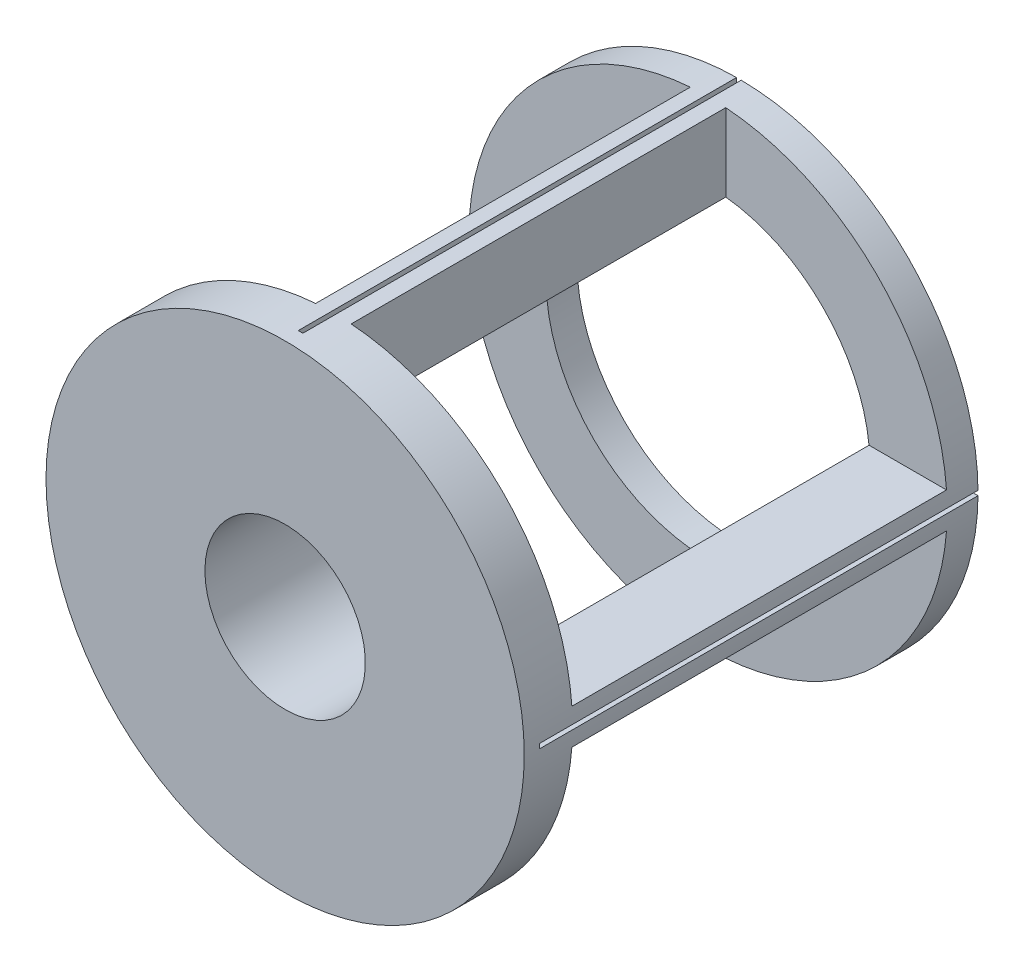
from build123d import *
from build123d.topology import SkipClean

# Parameters (mm, degrees)
CUT_EXTRUDE2_REACH = 368.826
CUT_EXTRUDE3_REACH = 388.826
CUT_EXTRUDE3_START = -20


with BuildPart() as part:
    # Sketch1 → Revolve1 (revolve)
    with BuildSketch(Plane(origin=(0, 0, 0), x_dir=(1, 0, 0), z_dir=(0, 1, 0)), mode=Mode.PRIVATE) as revolve1_sk:
        Polygon((52, -44.128440367), (52, 30), (62, 30), (62, 0), (105, -15.779816514), (105, 250), (155, 250), (155, -44.128440367), align=None)
    revolve(revolve1_sk.sketch.rotate(Axis((0, 0, 0), (0, 0, 1)), 180), axis=Axis((0, 0, 0), (0, 0, 1)))

    # Cut-Extrude2: up to this cone (the profile starts outside it)
    with SkipClean():  # the faces are left unmerged after this step: merging them gives an invalid solid
        cut_extrude2_end = Plane(origin=(0, 0, -250), z_dir=(0, 0, 1)).offset(227.247707422) * Cone(2.725e-06, 387.16335, 142.078292578, align=(Align.CENTER, Align.CENTER, Align.MIN), mode=Mode.PRIVATE)
        # Sketch2 → Cut-Extrude2 (cut, up to the surface)
        with BuildSketch(Plane(origin=(0, 0, -250), x_dir=(-1, 0, 0), z_dir=(0, 0, -1)), mode=Mode.PRIVATE) as cut_extrude2_sk1:
            with BuildLine():
                Line((-1.5, 154.992741766), (-1.5, 104.989285168))
                ThreePointArc((-1.5, 104.989285168), (0, 105), (1.5, 104.989285168))
                Line((1.5, 104.989285168), (1.5, 154.992741766))
                ThreePointArc((1.5, 154.992741766), (0, 155), (-1.5, 154.992741766))
            make_face()
        cut_extrude2_tool1 = extrude(cut_extrude2_sk1.sketch, amount=-CUT_EXTRUDE2_REACH, mode=Mode.PRIVATE) - cut_extrude2_end
        add(cut_extrude2_tool1.solids().sort_by_distance((0, 129.997004, -250))[0], mode=Mode.SUBTRACT)
        # Sketch2 → Cut-Extrude2 (cut, up to the surface)
        with BuildSketch(Plane(origin=(0, 0, -250), x_dir=(-1, 0, 0), z_dir=(0, 0, -1)), mode=Mode.PRIVATE) as cut_extrude2_sk2:
            with BuildLine():
                Line((104.989285168, 1.5), (154.992741766, 1.5))
                ThreePointArc((154.992741766, 1.5), (155, 0), (154.992741766, -1.5))
                Line((154.992741766, -1.5), (104.989285168, -1.5))
                ThreePointArc((104.989285168, -1.5), (105, 0), (104.989285168, 1.5))
            make_face()
        cut_extrude2_tool2 = extrude(cut_extrude2_sk2.sketch, amount=-CUT_EXTRUDE2_REACH, mode=Mode.PRIVATE) - cut_extrude2_end
        add(cut_extrude2_tool2.solids().sort_by_distance((-129.997004, 0, -250))[0], mode=Mode.SUBTRACT)
        # Sketch2 → Cut-Extrude2 (cut, up to the surface)
        with BuildSketch(Plane(origin=(0, 0, -250), x_dir=(-1, 0, 0), z_dir=(0, 0, -1)), mode=Mode.PRIVATE) as cut_extrude2_sk3:
            with BuildLine():
                Line((-1.5, -104.989285168), (-1.5, -154.992741766))
                ThreePointArc((-1.5, -154.992741766), (0, -155), (1.5, -154.992741766))
                Line((1.5, -154.992741766), (1.5, -104.989285168))
                ThreePointArc((1.5, -104.989285168), (0, -105), (-1.5, -104.989285168))
            make_face()
        cut_extrude2_tool3 = extrude(cut_extrude2_sk3.sketch, amount=-CUT_EXTRUDE2_REACH, mode=Mode.PRIVATE) - cut_extrude2_end
        add(cut_extrude2_tool3.solids().sort_by_distance((0, -129.997004, -250))[0], mode=Mode.SUBTRACT)
        # Sketch2 → Cut-Extrude2 (cut, up to the surface)
        with BuildSketch(Plane(origin=(0, 0, -250), x_dir=(-1, 0, 0), z_dir=(0, 0, -1)), mode=Mode.PRIVATE) as cut_extrude2_sk4:
            with BuildLine():
                Line((-154.992741766, 1.5), (-104.989285168, 1.5))
                ThreePointArc((-104.989285168, 1.5), (-105, 0), (-104.989285168, -1.5))
                Line((-104.989285168, -1.5), (-154.992741766, -1.5))
                ThreePointArc((-154.992741766, -1.5), (-155, 0), (-154.992741766, 1.5))
            make_face()
        cut_extrude2_tool4 = extrude(cut_extrude2_sk4.sketch, amount=-CUT_EXTRUDE2_REACH, mode=Mode.PRIVATE) - cut_extrude2_end
        add(cut_extrude2_tool4.solids().sort_by_distance((129.997004, 0, -250))[0], mode=Mode.SUBTRACT)

    # Cut-Extrude3: up to this cone (the profile starts outside it)
    with SkipClean():  # the faces are left unmerged after this step: merging them gives an invalid solid
        cut_extrude3_end = Plane(origin=(0, 0, -230), z_dir=(0, 0, 1)).offset(185.943540704) * Cone(2.725e-06, 554.217204308, 203.382459296, align=(Align.CENTER, Align.CENTER, Align.MIN), mode=Mode.PRIVATE)
        # Sketch4 → Cut-Extrude3 (cut, up to the surface)
        with BuildSketch(Plane(origin=(0, 0, -250), x_dir=(-1, 0, 0), z_dir=(0, 0, -1)).offset(CUT_EXTRUDE3_START), mode=Mode.PRIVATE) as cut_extrude3_sk1:
            with BuildLine():
                Line((-154.572798383, -11.5), (-104.368338111, -11.5))
                ThreePointArc((-104.368338111, -11.5), (-74.246212025, -74.246212025), (-11.5, -104.368338111))
                Line((-11.5, -104.368338111), (-11.5, -154.572798383))
                ThreePointArc((-11.5, -154.572798383), (-109.601551084, -109.601551084), (-154.572798383, -11.5))
            make_face()
        cut_extrude3_tool1 = extrude(cut_extrude3_sk1.sketch, amount=-CUT_EXTRUDE3_REACH, mode=Mode.PRIVATE) - cut_extrude3_end
        add(cut_extrude3_tool1.solids().sort_by_distance((85.813767, -85.813767, -230))[0], mode=Mode.SUBTRACT)
        # Sketch4 → Cut-Extrude3 (cut, up to the surface)
        with BuildSketch(Plane(origin=(0, 0, -250), x_dir=(-1, 0, 0), z_dir=(0, 0, -1)).offset(CUT_EXTRUDE3_START), mode=Mode.PRIVATE) as cut_extrude3_sk2:
            with BuildLine():
                Line((11.5, -104.368338111), (11.5, -154.572798383))
                ThreePointArc((11.5, -154.572798383), (109.601551084, -109.601551084), (154.572798383, -11.5))
                Line((154.572798383, -11.5), (104.368338111, -11.5))
                ThreePointArc((104.368338111, -11.5), (74.246212025, -74.246212025), (11.5, -104.368338111))
            make_face()
        cut_extrude3_tool2 = extrude(cut_extrude3_sk2.sketch, amount=-CUT_EXTRUDE3_REACH, mode=Mode.PRIVATE) - cut_extrude3_end
        add(cut_extrude3_tool2.solids().sort_by_distance((-85.813767, -85.813767, -230))[0], mode=Mode.SUBTRACT)
        # Sketch4 → Cut-Extrude3 (cut, up to the surface)
        with BuildSketch(Plane(origin=(0, 0, -250), x_dir=(-1, 0, 0), z_dir=(0, 0, -1)).offset(CUT_EXTRUDE3_START), mode=Mode.PRIVATE) as cut_extrude3_sk3:
            with BuildLine():
                Line((154.572798383, 11.5), (104.368338111, 11.5))
                ThreePointArc((104.368338111, 11.5), (74.246212025, 74.246212025), (11.5, 104.368338111))
                Line((11.5, 104.368338111), (11.5, 154.572798383))
                ThreePointArc((11.5, 154.572798383), (109.601551084, 109.601551084), (154.572798383, 11.5))
            make_face()
        cut_extrude3_tool3 = extrude(cut_extrude3_sk3.sketch, amount=-CUT_EXTRUDE3_REACH, mode=Mode.PRIVATE) - cut_extrude3_end
        add(cut_extrude3_tool3.solids().sort_by_distance((-85.813767, 85.813767, -230))[0], mode=Mode.SUBTRACT)
        # Sketch4 → Cut-Extrude3 (cut, up to the surface)
        with BuildSketch(Plane(origin=(0, 0, -250), x_dir=(-1, 0, 0), z_dir=(0, 0, -1)).offset(CUT_EXTRUDE3_START), mode=Mode.PRIVATE) as cut_extrude3_sk4:
            with BuildLine():
                Line((-11.5, 104.368338111), (-11.5, 154.572798383))
                ThreePointArc((-11.5, 154.572798383), (-109.601551084, 109.601551084), (-154.572798383, 11.5))
                Line((-154.572798383, 11.5), (-104.368338111, 11.5))
                ThreePointArc((-104.368338111, 11.5), (-74.246212025, 74.246212025), (-11.5, 104.368338111))
            make_face()
        cut_extrude3_tool4 = extrude(cut_extrude3_sk4.sketch, amount=-CUT_EXTRUDE3_REACH, mode=Mode.PRIVATE) - cut_extrude3_end
        add(cut_extrude3_tool4.solids().sort_by_distance((85.813767, 85.813767, -230))[0], mode=Mode.SUBTRACT)


solid = part.part
